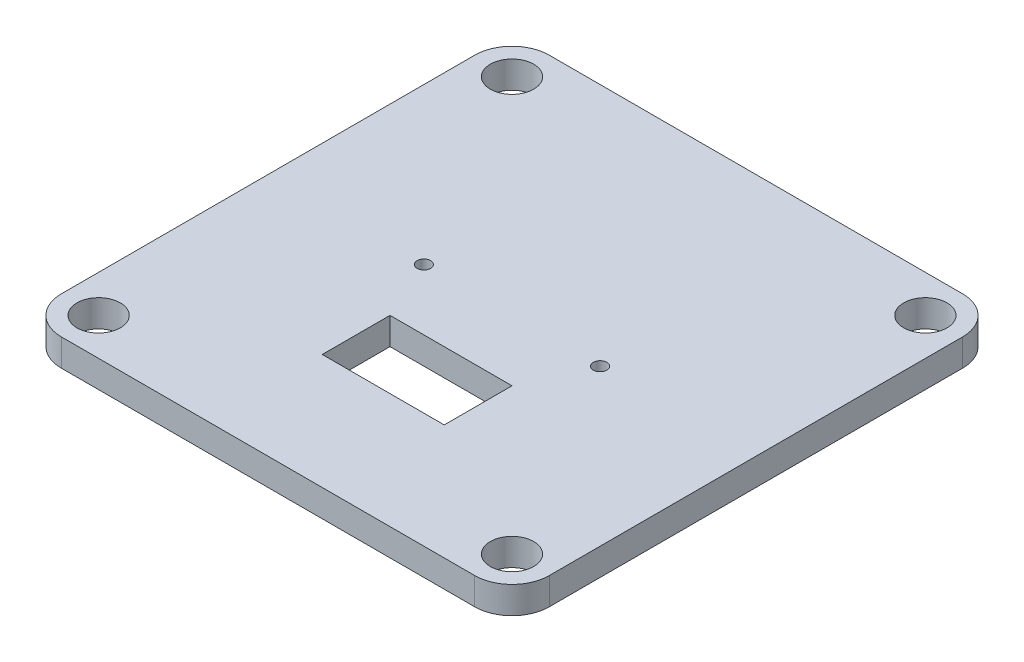
from build123d import *

# Parameters (mm, degrees)
SKETCH_1_R      = 1.6
SKETCH_1_R_2    = 0.5
SKETCH_1_W      = 9
SKETCH_1_H      = 5
EXTRUDE_1_DEPTH = 2


with BuildPart() as part:
    # 草图1 → 凸台-拉伸1 (new body)
    with BuildSketch(Plane(origin=(0, 0, 0), x_dir=(1, 0, 0), z_dir=(0, 1, 0))):
        with BuildLine():
            Line((-15.25, -18), (15.25, -18))
            ThreePointArc((15.25, -18), (17.194543648, -17.194543648), (18, -15.25))
            Line((18, -15.25), (18, 15.25))
            ThreePointArc((18, 15.25), (17.194543648, 17.194543648), (15.25, 18))
            Line((15.25, 18), (-15.25, 18))
            ThreePointArc((-15.25, 18), (-17.194543648, 17.194543648), (-18, 15.25))
            Line((-18, 15.25), (-18, -15.25))
            ThreePointArc((-18, -15.25), (-17.194543648, -17.194543648), (-15.25, -18))
        make_face()
        with Locations(Location((15.25, 15.25, 0), (0, 0, 270))):
            Circle(SKETCH_1_R, mode=Mode.SUBTRACT)
        with Locations(Location((15.25, -15.25, 0), (0, 0, 270))):
            Circle(SKETCH_1_R, mode=Mode.SUBTRACT)
        with Locations(Location((-15.25, -15.25, 0), (0, 0, 270))):
            Circle(SKETCH_1_R, mode=Mode.SUBTRACT)
        with Locations(Location((-15.25, 15.25, 0), (0, 0, 270))):
            Circle(SKETCH_1_R, mode=Mode.SUBTRACT)
        with Locations(Location((-6.5, 0, 0), (0, 0, 270))):
            Circle(SKETCH_1_R_2, mode=Mode.SUBTRACT)
        with Locations(Location((6.5, 0, 0), (0, 0, 90))):
            Circle(SKETCH_1_R_2, mode=Mode.SUBTRACT)
        with Locations((0, -7)):
            Rectangle(SKETCH_1_W, SKETCH_1_H, mode=Mode.SUBTRACT)
    extrude(amount=EXTRUDE_1_DEPTH)


solid = part.part
